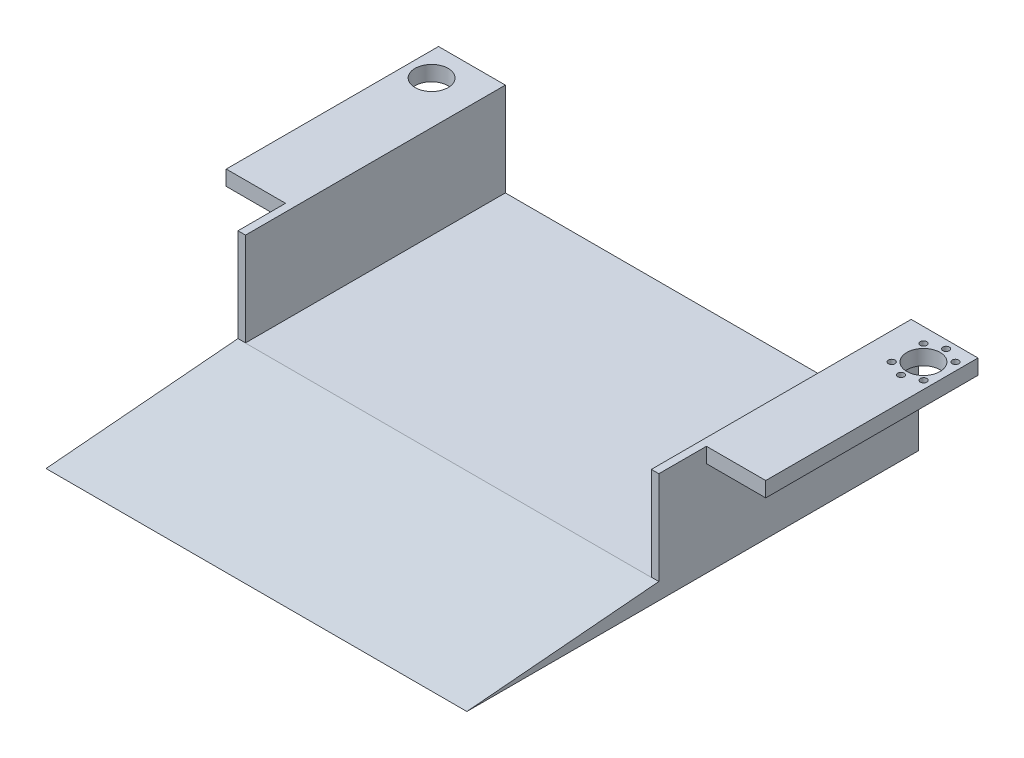
from build123d import *

# Parameters (mm, degrees)
SKETCH1_W           = 454.914
SKETCH1_H           = 381
BOSS_EXTRUDE1_DEPTH = 92.6973
SKETCH3_W           = 50.0126
SKETCH3_H           = 202.0062
CUT_EXTRUDE1_DEPTH  = 601.583496962
SKETCH4_R           = 14
CUT_EXTRUDE2_DEPTH  = 601.583496962
SKETCH5_W           = 342.1888
SKETCH5_H           = 381
CUT_EXTRUDE3_DEPTH  = 78.74
SKETCH6_W           = 178.9938
SKETCH6_H           = 79.9974
CUT_EXTRUDE4_DEPTH  = 50.0126
SKETCH7_W           = 178.9938
SKETCH7_H           = 79.9974
CUT_EXTRUDE5_DEPTH  = 50.0126
CUT_EXTRUDE6_DEPTH  = 564.647880462
SKETCH11_R          = 2.75
CUT_EXTRUDE7_DEPTH  = 601.583496962


with BuildPart() as part:
    # Sketch1 → Boss-Extrude1 (new body)
    with BuildSketch(Plane(origin=(0, 0, 0), x_dir=(1, 0, 0), z_dir=(0, 1, 0))):
        with Locations((227.457, 190.5)):
            Rectangle(SKETCH1_W, SKETCH1_H)
    extrude(amount=BOSS_EXTRUDE1_DEPTH)

    # Sketch3 → Cut-Extrude1 (cut, through all)
    with BuildSketch(Plane(origin=(0, 92.6973, 0), x_dir=(1, 0, 0), z_dir=(0, 1, 0))):
        with Locations((429.9077, 101.0031)):
            Rectangle(SKETCH3_W, SKETCH3_H)
        with Locations((25.0063, 101.0031)):
            Rectangle(SKETCH3_W, SKETCH3_H)
    extrude(amount=-CUT_EXTRUDE1_DEPTH, mode=Mode.SUBTRACT)

    # Sketch4 → Cut-Extrude2 (cut, through all)
    with BuildSketch(Plane(origin=(0, 92.6973, 0), x_dir=(1, 0, 0), z_dir=(0, 1, 0))):
        with Locations(Location((20.066, 355.092, 0), (0, 0, 270))):
            Circle(SKETCH4_R)
        with Locations(Location((434.848, 355.092, 0), (0, 0, 270))):
            Circle(SKETCH4_R)
    extrude(amount=-CUT_EXTRUDE2_DEPTH, mode=Mode.SUBTRACT)

    # Sketch5 → Cut-Extrude3 (cut)
    with BuildSketch(Plane(origin=(0, 92.6973, 0), x_dir=(1, 0, 0), z_dir=(0, 1, 0))):
        with Locations((227.457, 190.5)):
            Rectangle(SKETCH5_W, SKETCH5_H)
    extrude(amount=-CUT_EXTRUDE3_DEPTH, mode=Mode.SUBTRACT)

    # Sketch6 → Cut-Extrude4 (cut)
    with BuildSketch(Plane(origin=(454.914, 0, 0), x_dir=(0, 0, -1), z_dir=(1, 0, 0))):
        with Locations((291.5031, 39.9987)):
            Rectangle(SKETCH6_W, SKETCH6_H)
    extrude(amount=-CUT_EXTRUDE4_DEPTH, mode=Mode.SUBTRACT)

    # Sketch7 → Cut-Extrude5 (cut)
    with BuildSketch(Plane.ZY):
        with Locations((-291.5031, 39.9987)):
            Rectangle(SKETCH7_W, SKETCH7_H)
    extrude(amount=-CUT_EXTRUDE5_DEPTH, mode=Mode.SUBTRACT)

    # Sketch10 → Cut-Extrude6 (cut, through all)
    with BuildSketch(Plane(origin=(404.9014, 0, 0), x_dir=(0, 0, -1), z_dir=(1, 0, 0))):
        Polygon((0, 0), (161.899498709, 13.97), (161.899498709, 92.6973), (0, 92.6973), align=None)
    extrude(amount=-CUT_EXTRUDE6_DEPTH, mode=Mode.SUBTRACT)

    # Sketch11 → Cut-Extrude7 (cut, through all)
    with BuildSketch(Plane(origin=(0, 92.6973, 0), x_dir=(1, 0, 0), z_dir=(0, 1, 0))):
        with Locations(Location((434.848, 374.174211985, 0), (0, 0, 270))):
            Circle(SKETCH11_R)
        with Locations(Location((448.283028843, 368.609240827, 0), (0, 0, 270))):
            Circle(SKETCH11_R)
        with Locations(Location((421.412971157, 368.609240827, 0), (0, 0, 270))):
            Circle(SKETCH11_R)
        with Locations(Location((448.283028843, 341.739183142, 0), (0, 0, 270))):
            Circle(SKETCH11_R)
        with Locations(Location((434.848, 336.174211985, 0), (0, 0, 270))):
            Circle(SKETCH11_R)
        with Locations(Location((421.412971157, 341.739183142, 0), (0, 0, 270))):
            Circle(SKETCH11_R)
    extrude(amount=-CUT_EXTRUDE7_DEPTH, mode=Mode.SUBTRACT)


solid = part.part
